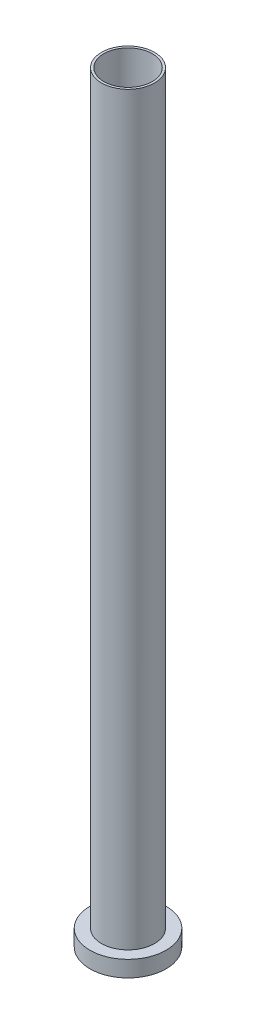
from build123d import *

# Parameters (mm, degrees)
SKETCH1_R           = 11.5
SKETCH1_R_2         = 10.5
BOSS_EXTRUDE1_DEPTH = 330
SKETCH2_R           = 16.5
SKETCH2_R_2         = 10.5
BOSS_EXTRUDE2_DEPTH = 7


with BuildPart() as part:
    # Sketch1 → Boss-Extrude1 (new body)
    with BuildSketch(Plane(origin=(0, 0, 0), x_dir=(1, 0, 0), z_dir=(0, 1, 0))):
        with Locations(Location((0, 0, 0), (0, 0, 270))):
            Circle(SKETCH1_R)
        with Locations(Location((0, 0, 0), (0, 0, 270))):
            Circle(SKETCH1_R_2, mode=Mode.SUBTRACT)
    extrude(amount=BOSS_EXTRUDE1_DEPTH)

    # Sketch2 → Boss-Extrude2 (add)
    with BuildSketch(Plane.XZ):
        with Locations(Location((0, 0, 0), (0, 0, 270))):
            Circle(SKETCH2_R)
        with Locations(Location((0, 0, 0), (0, 0, 90))):
            Circle(SKETCH2_R_2, mode=Mode.SUBTRACT)
    extrude(amount=-BOSS_EXTRUDE2_DEPTH)


solid = part.part
